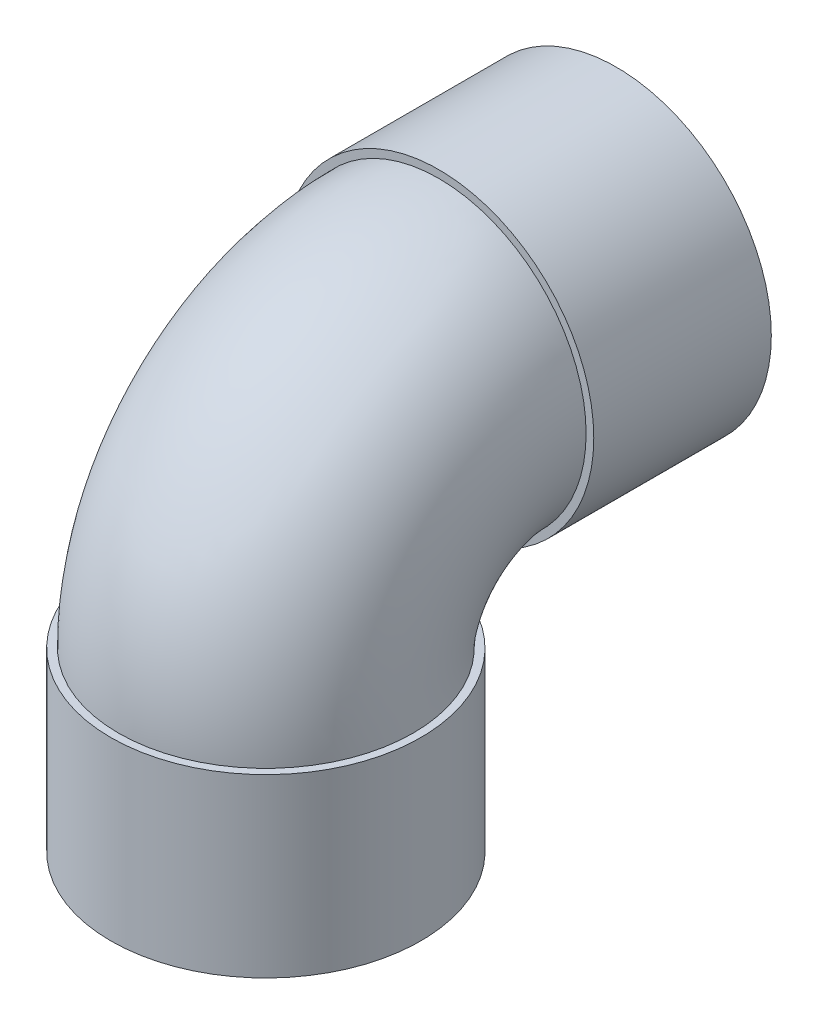
from build123d import *

# Parameters (mm, degrees)
ESQUISSE1_R        = 26.14
ESQUISSE1_R_2      = 22.14
R_VOL_MINCE1_ANGLE = 90
ESQUISSE2_R        = 27.5
ESQUISSE2_R_2      = 25.25
EXTRU_MINCE1_DEPTH = 31.5
ESQUISSE3_R        = 27.5
ESQUISSE3_R_2      = 25.25
EXTRU_MINCE2_DEPTH = 31.25


with BuildPart() as part:
    # Esquisse1 → Révol.-Mince1 (revolve)
    with BuildSketch(Plane.XY):
        Circle(ESQUISSE1_R)
        Circle(ESQUISSE1_R_2, mode=Mode.SUBTRACT)
    revolve(axis=Axis((0, -30.683141542, 0), (1, 0, 0)), revolution_arc=R_VOL_MINCE1_ANGLE)

    # Esquisse2 → Extru.-Mince1 (add)
    with BuildSketch(Plane(origin=(0, 0, 0), x_dir=(-1, 0, 0), z_dir=(0, 0, -1))):
        Circle(ESQUISSE2_R)
        Circle(ESQUISSE2_R_2, mode=Mode.SUBTRACT)
    extrude(amount=EXTRU_MINCE1_DEPTH)

    # Esquisse3 → Extru.-Mince2 (add)
    with BuildSketch(Plane.XZ.offset(30.683141542)):
        with Locations((0, 30.683141542)):
            Circle(ESQUISSE3_R)
        with Locations((0, 30.683141542)):
            Circle(ESQUISSE3_R_2, mode=Mode.SUBTRACT)
    extrude(amount=EXTRU_MINCE2_DEPTH)


solid = part.part
